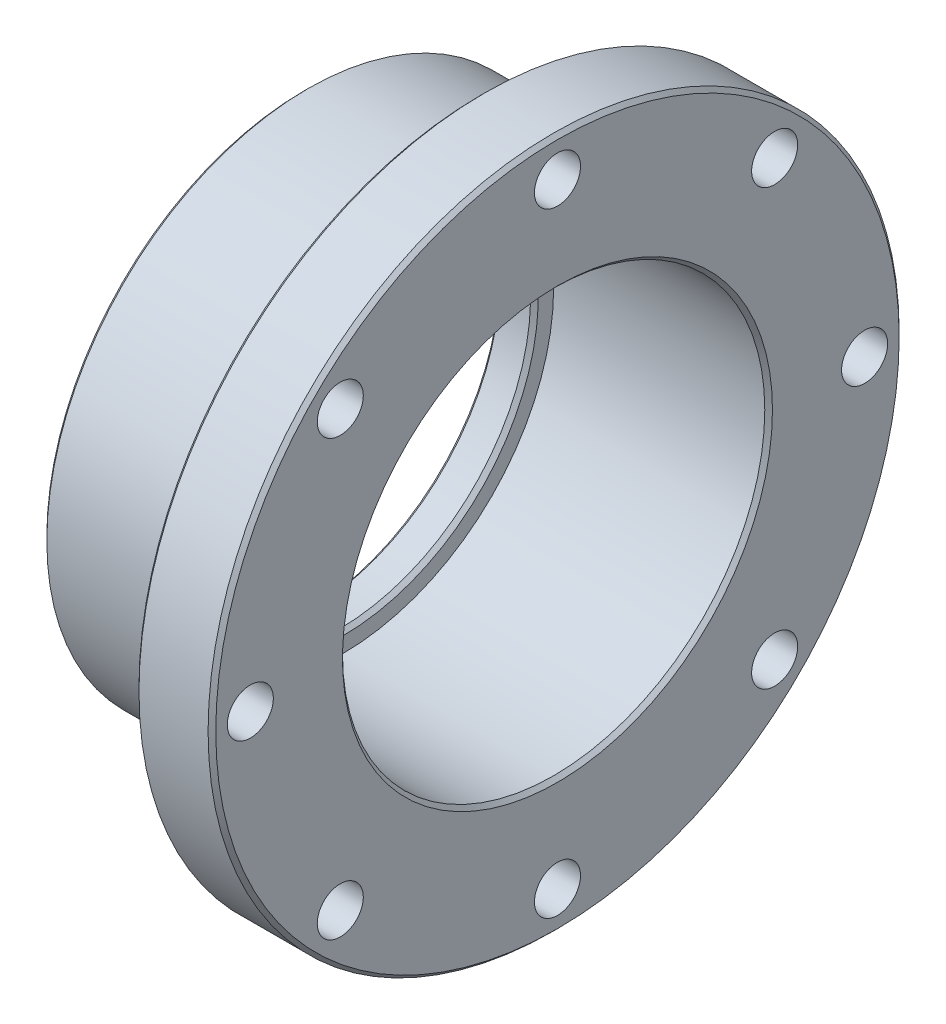
from build123d import *

# Parameters (mm, degrees)
CUT_EXTRUDE_1_REACH = 69.668
SKETCH_3_R          = 3
CHAMFER_1_SIZE      = 0.5


with BuildPart() as part:
    # 草图1 → 旋转1 (revolve)
    with BuildSketch(Plane.XY, mode=Mode.PRIVATE) as revolve_1_sk:
        Polygon((0, 0), (0, 34), (23, 34), (23, 45), (33, 45), (33, 0), align=None)
    revolve(revolve_1_sk.sketch.rotate(Axis((0, 0, 0), (-1, 0, 0)), 90), axis=Axis((0, 0, 0), (-1, 0, 0)))

    # 草图2 → 切除-旋转1 (revolve, cut)
    with BuildSketch(Plane.XY):
        Polygon((0, 0), (0, 25), (5, 25), (5, 27.5), (33, 27.5), (33, 0), align=None)
    revolve(axis=Axis((0, 0, 0), (-1, 0, 0)), mode=Mode.SUBTRACT)

    # 草图3 → 切除-拉伸1 (cut, up to next)
    with BuildSketch(Plane.ZY.offset(-23), mode=Mode.PRIVATE) as cut_extrude_1_sk1:
        with Locations((0, 40)):
            Circle(SKETCH_3_R)
    cut_extrude_1_tool1 = extrude(cut_extrude_1_sk1.sketch, amount=-CUT_EXTRUDE_1_REACH, mode=Mode.PRIVATE) & part.part
    # 草图3 → 切除-拉伸1 (cut, up to next)
    with BuildSketch(Plane.ZY.offset(-23), mode=Mode.PRIVATE) as cut_extrude_1_sk2:
        with Locations((28.284271247, 28.284271247)):
            Circle(SKETCH_3_R)
    cut_extrude_1_tool2 = extrude(cut_extrude_1_sk2.sketch, amount=-CUT_EXTRUDE_1_REACH, mode=Mode.PRIVATE) & part.part
    # 草图3 → 切除-拉伸1 (cut, up to next)
    with BuildSketch(Plane.ZY.offset(-23), mode=Mode.PRIVATE) as cut_extrude_1_sk3:
        with Locations((40, 0)):
            Circle(SKETCH_3_R)
    cut_extrude_1_tool3 = extrude(cut_extrude_1_sk3.sketch, amount=-CUT_EXTRUDE_1_REACH, mode=Mode.PRIVATE) & part.part
    # 草图3 → 切除-拉伸1 (cut, up to next)
    with BuildSketch(Plane.ZY.offset(-23), mode=Mode.PRIVATE) as cut_extrude_1_sk4:
        with Locations((28.284271247, -28.284271247)):
            Circle(SKETCH_3_R)
    cut_extrude_1_tool4 = extrude(cut_extrude_1_sk4.sketch, amount=-CUT_EXTRUDE_1_REACH, mode=Mode.PRIVATE) & part.part
    # 草图3 → 切除-拉伸1 (cut, up to next)
    with BuildSketch(Plane.ZY.offset(-23), mode=Mode.PRIVATE) as cut_extrude_1_sk5:
        with Locations((0, -40)):
            Circle(SKETCH_3_R)
    cut_extrude_1_tool5 = extrude(cut_extrude_1_sk5.sketch, amount=-CUT_EXTRUDE_1_REACH, mode=Mode.PRIVATE) & part.part
    # 草图3 → 切除-拉伸1 (cut, up to next)
    with BuildSketch(Plane.ZY.offset(-23), mode=Mode.PRIVATE) as cut_extrude_1_sk6:
        with Locations((-28.284271247, -28.284271247)):
            Circle(SKETCH_3_R)
    cut_extrude_1_tool6 = extrude(cut_extrude_1_sk6.sketch, amount=-CUT_EXTRUDE_1_REACH, mode=Mode.PRIVATE) & part.part
    # 草图3 → 切除-拉伸1 (cut, up to next)
    with BuildSketch(Plane.ZY.offset(-23), mode=Mode.PRIVATE) as cut_extrude_1_sk7:
        with Locations((-40, 0)):
            Circle(SKETCH_3_R)
    cut_extrude_1_tool7 = extrude(cut_extrude_1_sk7.sketch, amount=-CUT_EXTRUDE_1_REACH, mode=Mode.PRIVATE) & part.part
    # 草图3 → 切除-拉伸1 (cut, up to next)
    with BuildSketch(Plane.ZY.offset(-23), mode=Mode.PRIVATE) as cut_extrude_1_sk8:
        with Locations((-28.284271247, 28.284271247)):
            Circle(SKETCH_3_R)
    cut_extrude_1_tool8 = extrude(cut_extrude_1_sk8.sketch, amount=-CUT_EXTRUDE_1_REACH, mode=Mode.PRIVATE) & part.part
    add(cut_extrude_1_tool1.solids().sort_by_distance((23, 40, 0))[0], mode=Mode.SUBTRACT)
    add(cut_extrude_1_tool2.solids().sort_by_distance((23, 28.284271, 28.284271))[0], mode=Mode.SUBTRACT)
    add(cut_extrude_1_tool3.solids().sort_by_distance((23, 0, 40))[0], mode=Mode.SUBTRACT)
    add(cut_extrude_1_tool4.solids().sort_by_distance((23, -28.284271, 28.284271))[0], mode=Mode.SUBTRACT)
    add(cut_extrude_1_tool5.solids().sort_by_distance((23, -40, 0))[0], mode=Mode.SUBTRACT)
    add(cut_extrude_1_tool6.solids().sort_by_distance((23, -28.284271, -28.284271))[0], mode=Mode.SUBTRACT)
    add(cut_extrude_1_tool7.solids().sort_by_distance((23, 0, -40))[0], mode=Mode.SUBTRACT)
    add(cut_extrude_1_tool8.solids().sort_by_distance((23, 28.284271, -28.284271))[0], mode=Mode.SUBTRACT)

    # 倒角1
    chamfer_1_edges = [part.edges().sort_by_distance(p)[0] for p in [
        (0, -25, 0),
        (5, -25, 0),
        (33, -27.5, 0),
        (33, 0, 45),
        (23, 0, 45),
        (0, 0, 34),
    ]]
    chamfer(chamfer_1_edges, length=CHAMFER_1_SIZE)


solid = part.part
